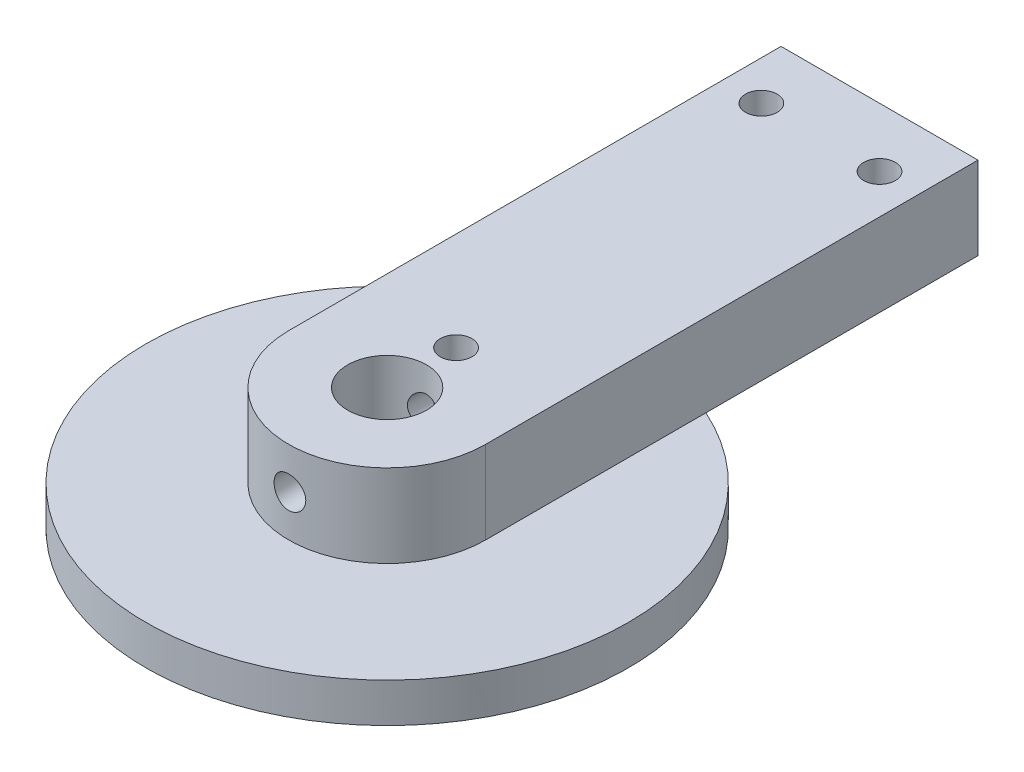
from build123d import *

# Parameters (mm, degrees)
BOSS_EXTRUDE1_DEPTH         = 13.352390271
SKETCH4_R                   = 38.89375
BOSS_EXTRUDE2_DEPTH         = 4.7625
CUT_EXTRUDE1_DEPTH          = 91.22895136
CUT_EXTRUDE1_DEPTH_BACK     = 91.22895136
SKETCH2_R                   = 6.35
SKETCH5_R                   = 38.89375
SKETCH5_R_2                 = 28.575
BOSS_EXTRUDE3_DEPTH         = 1.5875
F_1_4_20_TAPPED_HOLE1_D     = 5.1054
F_1_4_20_TAPPED_HOLE2_D     = 5.1054
F_1_4_20_TAPPED_HOLE2_DEPTH = 118.27002
F_1_4_20_TAPPED_HOLE2_TIP   = 1.533816902


with BuildPart() as part:
    # Sketch1 → Boss-Extrude1 (new body)
    with BuildSketch(Plane(origin=(0, 0, 0), x_dir=(1, 0, 0), z_dir=(0, 1, 0))):
        with BuildLine():
            Line((-15.875, 0), (-15.875, 79.375))
            Line((-15.875, 79.375), (15.875, 79.375))
            Line((15.875, 79.375), (15.875, 0))
            ThreePointArc((15.875, 0), (0, -15.875), (-15.875, 0))
        make_face()
    extrude(amount=BOSS_EXTRUDE1_DEPTH)

    # Sketch4 → Boss-Extrude2 (add)
    with BuildSketch(Plane.XZ):
        with Locations(Location((0, 0, 0), (0, 0, 245.910493888))):
            Circle(SKETCH4_R)
    extrude(amount=BOSS_EXTRUDE2_DEPTH)

    # Sketch2 → Cut-Extrude1 (cut, two sides: drawn at the far end of the back side and taken through both)
    with BuildSketch(Plane(origin=(0, 13.352390271, 0), x_dir=(1, 0, 0), z_dir=(0, 1, 0)).offset(-CUT_EXTRUDE1_DEPTH_BACK)):
        with Locations(Location((0, 0, 0), (0, 0, 270))):
            Circle(SKETCH2_R)
    extrude(amount=CUT_EXTRUDE1_DEPTH + CUT_EXTRUDE1_DEPTH_BACK, mode=Mode.SUBTRACT)

    # Sketch5 → Boss-Extrude3 (add)
    with BuildSketch(Plane.XZ.offset(4.7625)):
        with Locations(Location((0, 0, 0), (0, 0, 245.910493888))):
            Circle(SKETCH5_R)
        with Locations(Location((0, 0, 0), (0, 0, 270))):
            Circle(SKETCH5_R_2, mode=Mode.SUBTRACT)
    extrude(amount=BOSS_EXTRUDE3_DEPTH)

    # 1/4-20 Tapped Hole1 (through all)
    with Locations(Plane(origin=(0, 0, -79.375), x_dir=(-1, 0, 0), z_dir=(0, 0, -1))):
        with Locations((0, 6.676195135)):
            Hole(F_1_4_20_TAPPED_HOLE1_D / 2)

    # 1/4-20 Tapped Hole2
    with Locations(Plane(origin=(0, 13.352390271, 0), x_dir=(1, 0, 0), z_dir=(0, 1, 0))):
        with Locations((-9.525, 69.85), (9.525, 69.85), (0, 11.1125)):
            Hole(F_1_4_20_TAPPED_HOLE2_D / 2, depth=F_1_4_20_TAPPED_HOLE2_DEPTH)
            with Locations((0, 0, -(F_1_4_20_TAPPED_HOLE2_DEPTH + F_1_4_20_TAPPED_HOLE2_TIP / 2))):  # 118° drill point
                Cone(0, F_1_4_20_TAPPED_HOLE2_D / 2, F_1_4_20_TAPPED_HOLE2_TIP, mode=Mode.SUBTRACT)


solid = part.part
